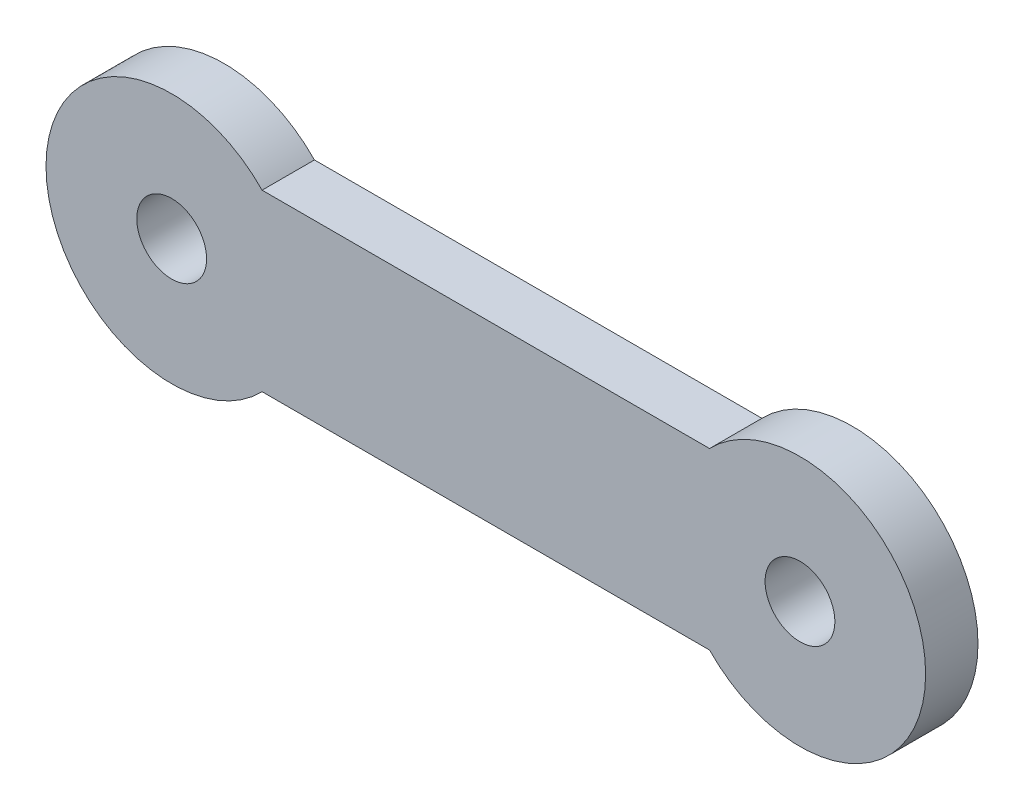
from build123d import *

# Parameters (mm, degrees)
SALIENTE_EXTRUIR1_DEPTH = 1.5
CROQUIS2_R              = 1
CORTAR_EXTRUIR1_DEPTH   = 1.5


with BuildPart() as part:
    # Croquis1 → Saliente-Extruir1 (new body)
    with BuildSketch(Plane.XY):
        with BuildLine():
            Line((2.590366769, -2.5), (15.409633231, -2.5))
            ThreePointArc((15.409633231, -2.5), (21.6, 0), (15.409633231, 2.5))
            Line((15.409633231, 2.5), (2.590366769, 2.5))
            ThreePointArc((2.590366769, 2.5), (-3.6, 0), (2.590366769, -2.5))
        make_face()
    extrude(amount=SALIENTE_EXTRUIR1_DEPTH)

    # Croquis2 → Cortar-Extruir1 (cut)
    with BuildSketch(Plane.XY.offset(1.5)):
        Circle(CROQUIS2_R)
        with Locations((18, 0)):
            Circle(CROQUIS2_R)
    extrude(amount=-CORTAR_EXTRUIR1_DEPTH, mode=Mode.SUBTRACT)


solid = part.part
